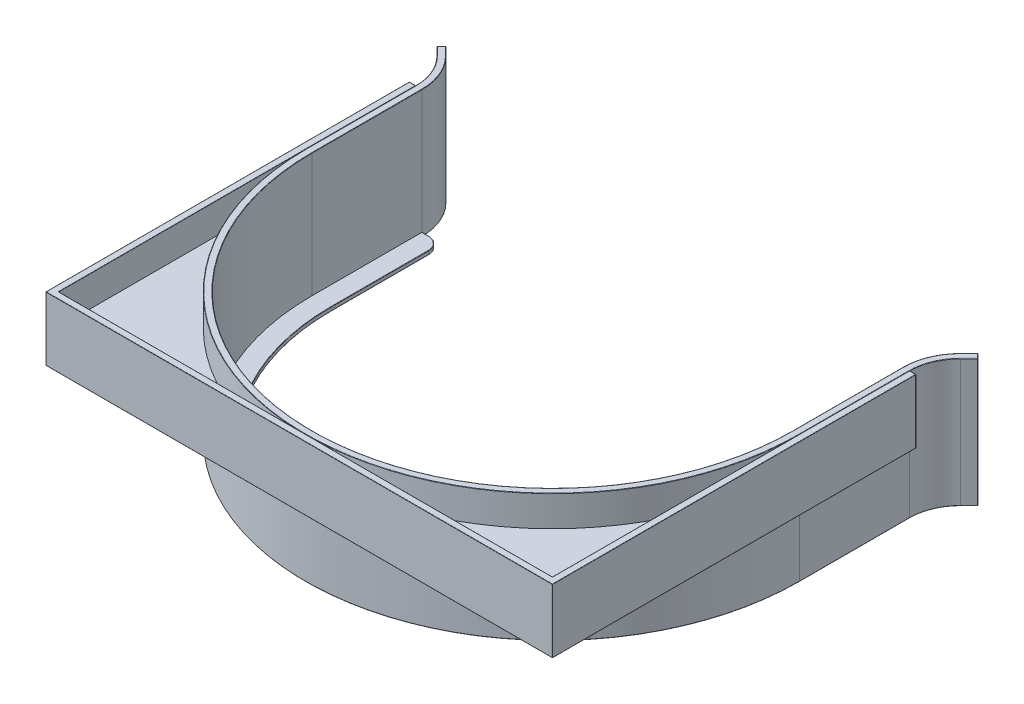
from build123d import *

# Parameters (mm, degrees)
BOSS_EXTRUDE1_DEPTH  = 100
BOSS_EXTRUDE2_DEPTH  = 100
BOSS_EXTRUDE3_DEPTH  = 3
FILLET1_R            = 10
BOSS_EXTRUDE4_DEPTH  = 50
BOSS_EXTRUDE10_DEPTH = 1
FILLET2_R            = 0.3
FILLET3_R            = 0.2


with BuildPart() as part:
    # Sketch1 → Boss-Extrude1 (new body)
    with BuildSketch(Plane(origin=(0, 0, 0), x_dir=(1, 0, 0), z_dir=(0, 1, 0))):
        with BuildLine():
            Line((193.5, 0), (188.5, 0))
            ThreePointArc((188.5, 0), (0, -188.5), (-188.5, 0))
            Line((-188.5, 0), (-193.5, 0))
            ThreePointArc((-193.5, 0), (0, -193.5), (193.5, 0))
        make_face()
    extrude(amount=BOSS_EXTRUDE1_DEPTH)

    # Sketch2 → Boss-Extrude2 (add)
    with BuildSketch(Plane(origin=(0, 0, 0), x_dir=(1, 0, 0), z_dir=(0, 1, 0))):
        with BuildLine():
            Line((-212.035533906, 121.464466094), (-205.215728753, 114.644660941))
            ThreePointArc((-205.215728753, 114.644660941), (-196.5448187, 101.667726988), (-193.5, 86.360389693))
            Line((-193.5, 86.360389693), (-193.5, 0))
            Line((-193.5, 0), (-188.5, 0))
            Line((-188.5, 0), (-188.5, 86.360389693))
            ThreePointArc((-188.5, 86.360389693), (-191.925421037, 103.58114415), (-201.680194847, 118.180194847))
            Line((-201.680194847, 118.180194847), (-208.5, 125))
            Line((-208.5, 125), (-212.035533906, 121.464466094))
        make_face()
    boss_extrude2 = extrude(amount=BOSS_EXTRUDE2_DEPTH)

    # Mirror1: Boss-Extrude2 across plane
    add(boss_extrude2.mirror(Plane(origin=(0, 0, 0), x_dir=(0, 0, 1), z_dir=(1, 0, 0))))

    # Sketch3 → Boss-Extrude3 (add)
    with BuildSketch(Plane(origin=(0, 0, 0), x_dir=(1, 0, 0), z_dir=(0, 1, 0))):
        with BuildLine():
            Line((-188.5, 0), (-188.5, 86.360389693))
            Line((-188.5, 86.360389693), (-173.5, 86.360389693))
            Line((-173.5, 86.360389693), (-173.5, 0))
            ThreePointArc((-173.5, 0), (0, -173.5), (173.5, 0))
            Line((173.5, 0), (173.5, 86.360389693))
            Line((173.5, 86.360389693), (188.5, 86.360389693))
            Line((188.5, 86.360389693), (188.5, 0))
            ThreePointArc((188.5, 0), (0, -188.5), (-188.5, 0))
        make_face()
    extrude(amount=BOSS_EXTRUDE3_DEPTH)

    # Fillet1
    fillet1_edges = [part.edges().sort_by_distance(p)[0] for p in [
        (-173.5, 1.5, -86.360389693),
        (173.5, 1.5, -86.360389693),
    ]]
    fillet(fillet1_edges, radius=FILLET1_R)

    # Fillet2
    fillet2_edges = [part.edges().sort_by_distance(p)[0] for p in [
        (-208.5, 50, -125),
        (-210.267766953, 0, -123.232233047),
        (-212.035533906, 50, -121.464466094),
        (-208.625631329, 0, -118.054563517),
        (-196.5448187, 0, -101.667726988),
        (-193.5, 0, -43.180194847),
        (0, 100, 188.5),
        (-191.925421037, 0, -103.58114415),
        (-205.090097423, 0, -121.590097423),
        (-205.090097423, 100, -121.590097423),
        (-210.267766953, 100, -123.232233047),
        (-208.625631329, 100, -118.054563517),
        (-196.5448187, 100, -101.667726988),
        (-193.5, 100, -43.180194847),
        (-188.5, 100, -43.180194847),
        (-191.925421037, 100, -103.58114415),
        (210.267766953, 0, -123.232233047),
        (208.625631329, 0, -118.054563517),
        (196.5448187, 0, -101.667726988),
        (193.5, 0, -43.180194847),
        (191.925421037, 0, -103.58114415),
        (205.090097423, 0, -121.590097423),
        (208.625631329, 100, -118.054563517),
        (196.5448187, 100, -101.667726988),
        (193.5, 100, -43.180194847),
        (188.5, 100, -43.180194847),
        (191.925421037, 100, -103.58114415),
        (205.090097423, 100, -121.590097423),
        (208.5, 50, -125),
        (210.267766953, 100, -123.232233047),
        (212.035533906, 50, -121.464466094),
        (186, 0, -86.360389693),
        (0, 0, 173.5),
        (-173.5, 0, -38.180194847),
        (186, 3, -86.360389693),
        (0, 3, 173.5),
        (-173.5, 3, -38.180194847),
        (0, 0, 193.5),
        (-186, 0, -86.360389693),
        (-186, 3, -86.360389693),
        (173.5, 0, -38.180194847),
        (176.428932188, 0, -83.431457505),
        (-176.428932188, 0, -83.431457505),
        (173.5, 3, -38.180194847),
        (176.428932188, 3, -83.431457505),
        (-176.428932188, 3, -83.431457505),
        (0, 100, 193.5),
    ]]
    fillet(fillet2_edges, radius=FILLET2_R)


with BuildPart() as body_2:
    # Sketch4 → Boss-Extrude4 (new body)
    with BuildSketch(Plane(origin=(0, 100, 0), x_dir=(1, 0, 0), z_dir=(0, 1, 0))):
        Polygon((-193.5, 86.360389693), (-193.5, -193.5), (193.5, -193.5), (193.5, 86.360389693), (198.5, 86.360389693), (198.5, -198.5), (-198.5, -198.5), (-198.5, 86.360389693), align=None)
    extrude(amount=-BOSS_EXTRUDE4_DEPTH)

    # Fillet3
    fillet3_edges = [body_2.edges().sort_by_distance(p)[0] for p in [
        (0, 50, 198.5),
        (-198.5, 100, 56.069805153),
        (-196, 100, -86.360389693),
        (198.5, 50, 56.069805153),
        (-193.5, 75, -86.360389693),
        (-193.5, 75, 193.5),
        (198.5, 75, -86.360389693),
        (198.5, 75, 198.5),
        (-198.5, 75, 198.5),
        (-198.5, 75, -86.360389693),
        (196, 50, -86.360389693),
        (193.5, 50, 53.569805153),
        (0, 50, 193.5),
        (-193.5, 50, 53.569805153),
        (-196, 50, -86.360389693),
        (-198.5, 50, 56.069805153),
        (-193.5, 100, 53.569805153),
        (0, 100, 193.5),
        (193.5, 100, 53.569805153),
        (196, 100, -86.360389693),
        (198.5, 100, 56.069805153),
        (0, 100, 198.5),
    ]]
    fillet(fillet3_edges, radius=FILLET3_R)


with BuildPart() as body_3:
    # Sketch6 → Boss-Extrude10 (new, symmetric)
    with BuildSketch(Plane(origin=(0, 75, 0), x_dir=(1, 0, 0), z_dir=(0, 1, 0))):
        with BuildLine():
            Line((-48.187135213, -193.5), (-193.5, -193.5))
            Line((-193.5, -193.5), (-193.5, -48.187135213))
            ThreePointArc((-193.5, -48.187135213), (-190.870681238, -45.210124057), (-187.591603053, -47.451453759))
            ThreePointArc((-187.591603053, -47.451453759), (-136.82516216, -136.82516216), (-47.451453759, -187.591603053))
            ThreePointArc((-47.451453759, -187.591603053), (-45.210124057, -190.870681238), (-48.187135213, -193.5))
        make_face()
    extrude(amount=BOSS_EXTRUDE10_DEPTH, both=True)


with BuildPart() as body_4:
    # Mirror3: mirrored copy
    add(body_3.part.mirror(Plane(origin=(0, 0, 0), x_dir=(0, 0, 1), z_dir=(1, 0, 0))))


solid = Compound([part.part, body_2.part, body_3.part, body_4.part])
